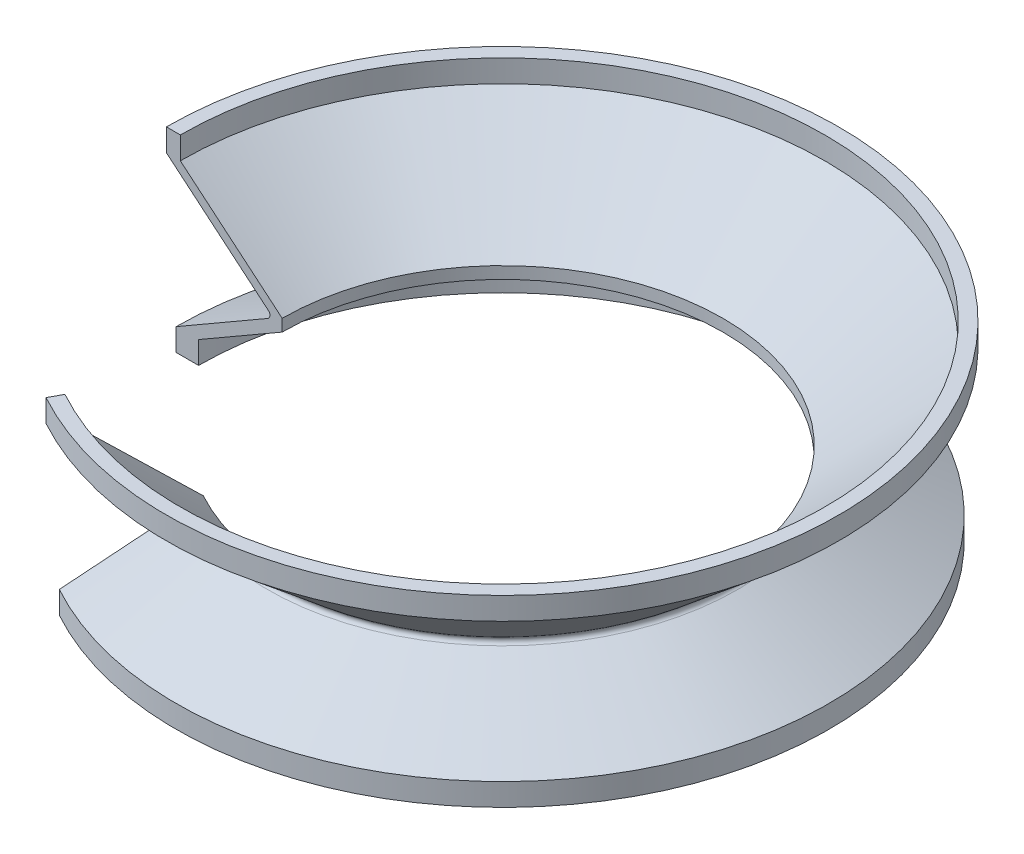
from build123d import *

# Parameters (mm, degrees)
REVOLVE1_ANGLE      = 298.8
FILLET2_R           = 0.4
BOSS_EXTRUDE1_DEPTH = 2
BOSS_EXTRUDE2_DEPTH = 2


with BuildPart() as part:
    # Sketch1 → Revolve1 (revolve)
    with BuildSketch(Plane.XY):
        Polygon((0.662781953, 0), (-8.871246788, 8), (-7.626667727, 8), (1.462781953, 0.373046127), (1.462781953, -0.692820323), (-5.997472085, -5), (-7.997472085, -5), align=None)
    revolve(axis=Axis((21.128753212, 7.609018033, 0), (0, -1, 0)), revolution_arc=REVOLVE1_ANGLE)

    # Fillet2
    fillet2_edges = [part.edges().sort_by_distance(p)[0] for p in [
        (38.744674798, 0, -10.418026985),
    ]]
    fillet(fillet2_edges, radius=FILLET2_R)

    # Sketch2 → Boss-Extrude1 (add)
    with BuildSketch(Plane(origin=(0, 8, 0), x_dir=(1, 0, 0), z_dir=(0, 1, 0))):
        with BuildLine():
            Line((7.275723524, -25.198567456), (6.676142989, -26.289200401))
            ThreePointArc((6.676142989, -26.289200401), (46.951014022, 15.271242473), (-8.871246788, 0))
            Line((-8.871246788, 0), (-7.626667727, 0))
            ThreePointArc((-7.626667727, 0), (45.879752518, 14.637700185), (7.275723524, -25.198567456))
        make_face()
    extrude(amount=BOSS_EXTRUDE1_DEPTH)

    # Sketch3 → Boss-Extrude2 (add)
    with BuildSketch(Plane.XZ.offset(5)):
        with BuildLine():
            Line((-7.997472085, 0), (-5.997472085, 0))
            ThreePointArc((-5.997472085, 0), (44.477435359, -13.808372129), (8.06059451, 23.770892432))
            Line((8.06059451, 23.770892432), (7.097087162, 25.523505792))
            ThreePointArc((7.097087162, 25.523505792), (46.198919413, -14.826454961), (-7.997472085, 0))
        make_face()
    extrude(amount=BOSS_EXTRUDE2_DEPTH)


solid = part.part
